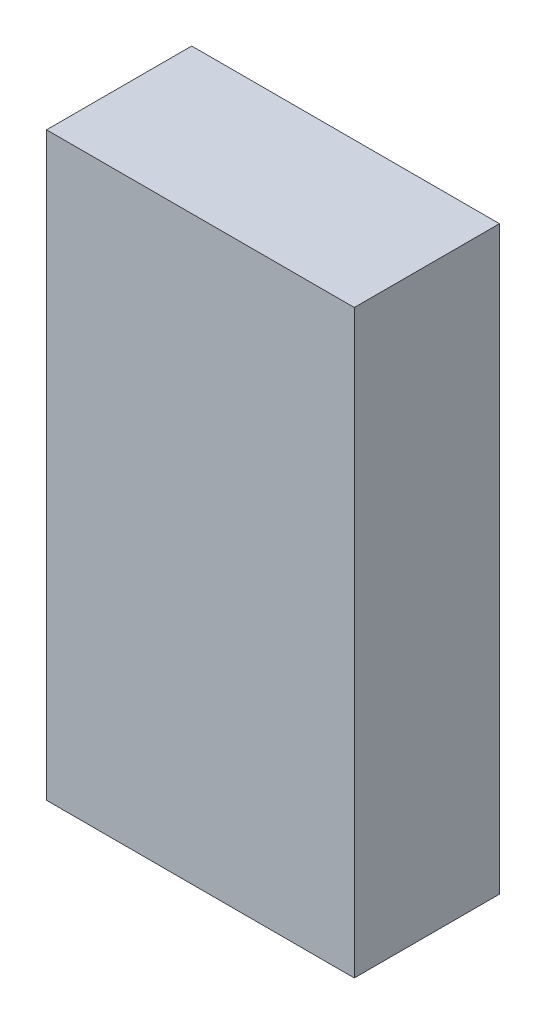
from build123d import *

# Parameters (mm, degrees)
SKETCH_1_W          = 106
SKETCH_1_H          = 45
EXTRUDE_1_DEPTH     = 200
SKETCH_2_W          = 86
SKETCH_2_H          = 180
CUT_EXTRUDE_1_DEPTH = 35
SKETCH_3_R          = 7.5
CUT_EXTRUDE_2_DEPTH = 210.842798304
SKETCH_4_W          = 24.030592061
SKETCH_4_H          = 7.207958271
CUT_EXTRUDE_4_DEPTH = 35
SKETCH_5_W          = 106
SKETCH_5_H          = 200
EXTRUDE_2_DEPTH     = 5


with BuildPart() as part:
    # 草圖1 → 填料-伸長1 (new body)
    with BuildSketch(Plane(origin=(0, 0, 0), x_dir=(1, 0, 0), z_dir=(0, 1, 0))):
        Rectangle(SKETCH_1_W, SKETCH_1_H)
    extrude(amount=EXTRUDE_1_DEPTH)

    # 草圖2 → 除料-伸長1 (cut)
    with BuildSketch(Plane.XY.offset(22.5)):
        with Locations((0, 100)):
            Rectangle(SKETCH_2_W, SKETCH_2_H)
    extrude(amount=-CUT_EXTRUDE_1_DEPTH, mode=Mode.SUBTRACT)

    # 草圖3 → 除料-伸長2 (cut, through all)
    with BuildSketch(Plane.XY.offset(-12.5)):
        with Locations((-26.696570332, 150.301958836)):
            Circle(SKETCH_3_R)
        with Locations((-1.696570332, 150.301958836)):
            Circle(SKETCH_3_R)
        with Locations((23.303429668, 150.301958836)):
            Circle(SKETCH_3_R)
    extrude(amount=-CUT_EXTRUDE_2_DEPTH, mode=Mode.SUBTRACT)

    # 草圖4 → 除料-伸長4 (cut)
    with BuildSketch(Plane.XZ):
        with Locations((-20.984703969, 10.896020865)):
            Rectangle(SKETCH_4_W, SKETCH_4_H)
    extrude(amount=-CUT_EXTRUDE_4_DEPTH, mode=Mode.SUBTRACT)

    # 草圖5 → 填料-伸長2 (add)
    with BuildSketch(Plane.XY.offset(22.5)):
        with Locations((0, 100)):
            Rectangle(SKETCH_5_W, SKETCH_5_H)
    extrude(amount=EXTRUDE_2_DEPTH)


solid = part.part
